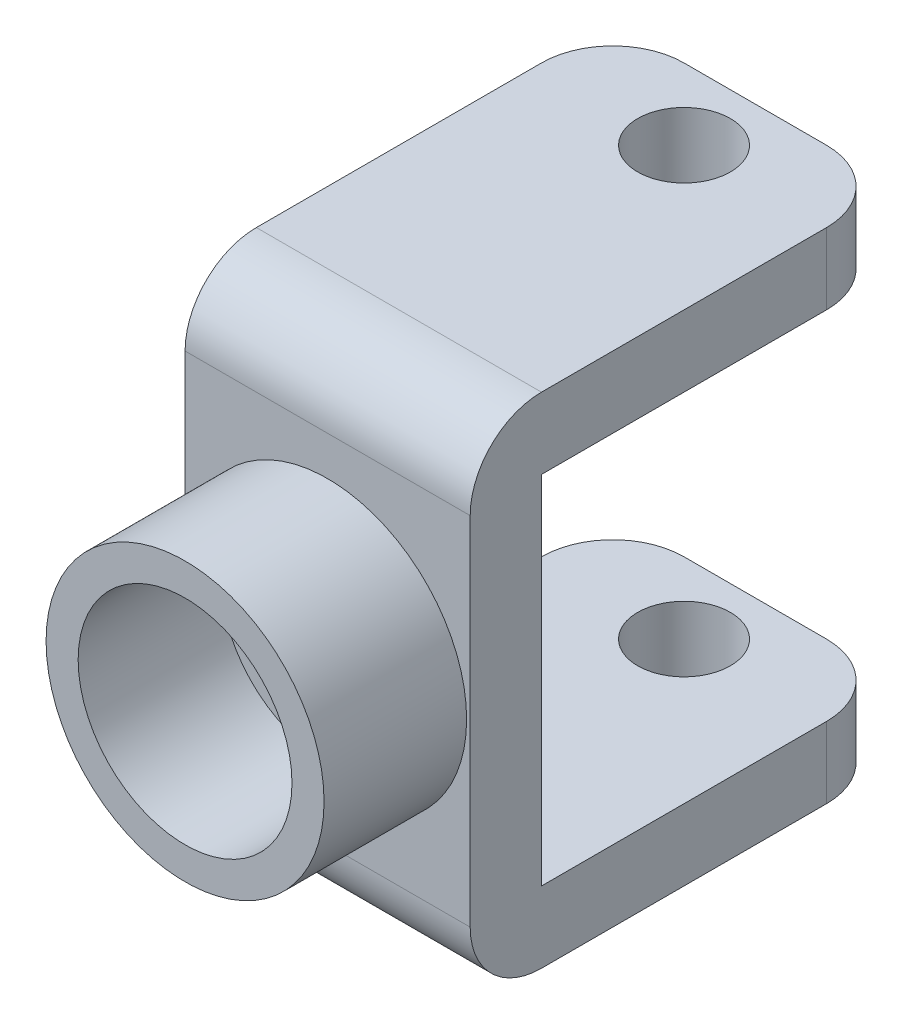
from build123d import *

# Parameters (mm, degrees)
SKETCH1_W           = 40
SKETCH1_H           = 50
BOSS_EXTRUDE1_DEPTH = 10
SKETCH3_W           = 60
SKETCH3_H           = 10
BOSS_EXTRUDE2_DEPTH = 20
FILLET1_R           = 10
SKETCH4_R           = 19.5
SKETCH4_R_2         = 15
BOSS_EXTRUDE3_DEPTH = 20
SKETCH5_R           = 6.5
CUT_EXTRUDE1_DEPTH  = 100


with BuildPart() as part:
    # Sketch1 → Boss-Extrude1 (new body)
    with BuildSketch(Plane.XY):
        Rectangle(SKETCH1_W, SKETCH1_H)
    extrude(amount=BOSS_EXTRUDE1_DEPTH)

    # Sketch3 → Boss-Extrude2 (add, symmetric)
    with BuildSketch(Plane(origin=(0, 0, 0), x_dir=(0, 0, -1), z_dir=(1, 0, 0))):
        with Locations((20, -30)):
            Rectangle(SKETCH3_W, SKETCH3_H)
        with Locations((20, 30)):
            Rectangle(SKETCH3_W, SKETCH3_H)
    extrude(amount=BOSS_EXTRUDE2_DEPTH, both=True)

    # Fillet1
    fillet1_edges = [part.edges().sort_by_distance(p)[0] for p in [
        (0, -35, 10),
        (-20, -30, -50),
        (20, -30, -50),
        (0, 35, 10),
        (-20, 30, -50),
        (20, 30, -50),
    ]]
    fillet(fillet1_edges, radius=FILLET1_R)

    # Sketch4 → Boss-Extrude3 (add)
    with BuildSketch(Plane.XY.offset(10)):
        Circle(SKETCH4_R)
        Circle(SKETCH4_R_2, mode=Mode.SUBTRACT)
    extrude(amount=BOSS_EXTRUDE3_DEPTH)

    # Sketch5 → Cut-Extrude1 (cut)
    with BuildSketch(Plane.XZ.offset(35)):
        with Locations(Location((0, -40, 0), (0, 0, 270))):
            Circle(SKETCH5_R)
    extrude(amount=-CUT_EXTRUDE1_DEPTH, mode=Mode.SUBTRACT)


solid = part.part
